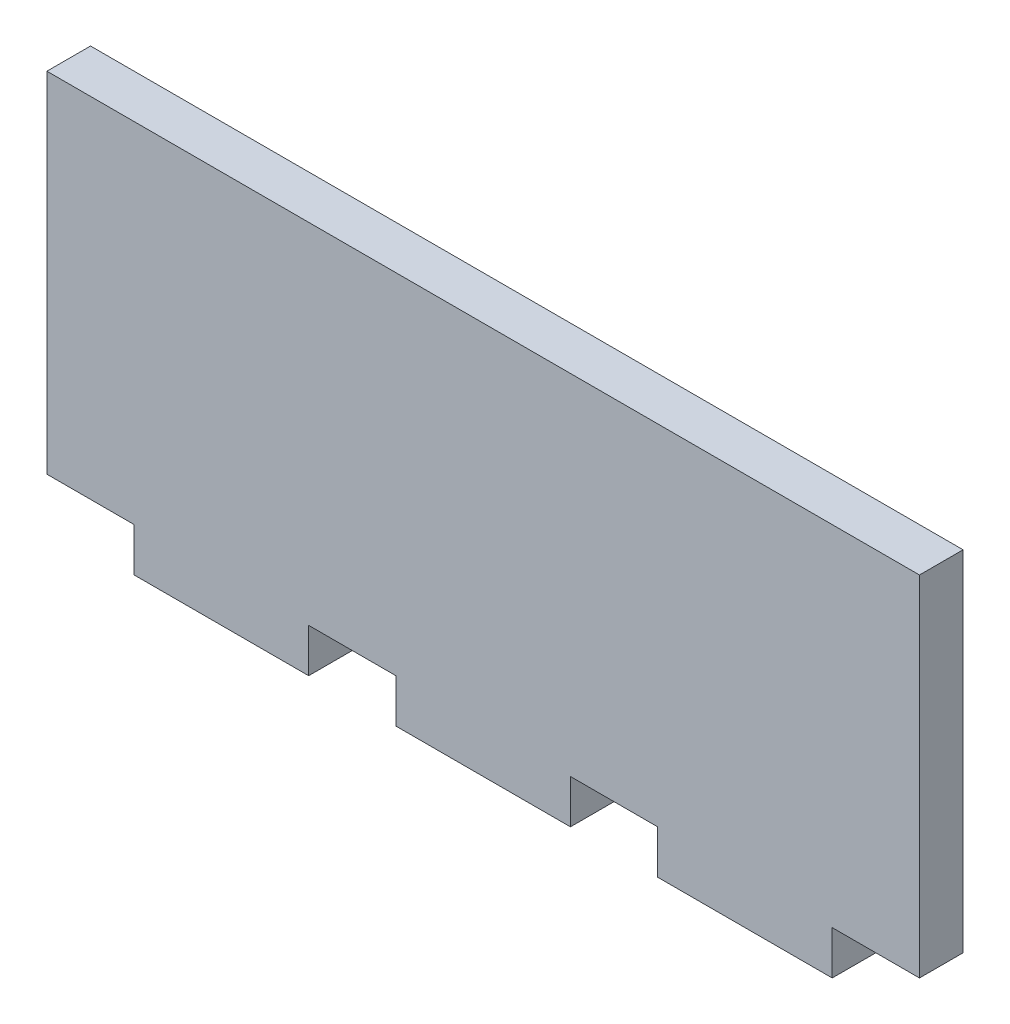
from build123d import *

# Parameters (mm, degrees)
BOSS_EXTRU_1_DEPTH = 5


with BuildPart() as part:
    # Esquisse1 → Boss.-Extru.1 (new body)
    with BuildSketch(Plane.XY):
        Polygon((-50, 22.5), (50, 22.5), (50, -17.5), (40, -17.5), (40, -22.5), (20, -22.5), (20, -17.5), (10, -17.5), (10, -22.5), (-10, -22.5), (-10, -17.5), (-20, -17.5), (-20, -22.5), (-40, -22.5), (-40, -17.5), (-50, -17.5), align=None)
    extrude(amount=BOSS_EXTRU_1_DEPTH)


solid = part.part
